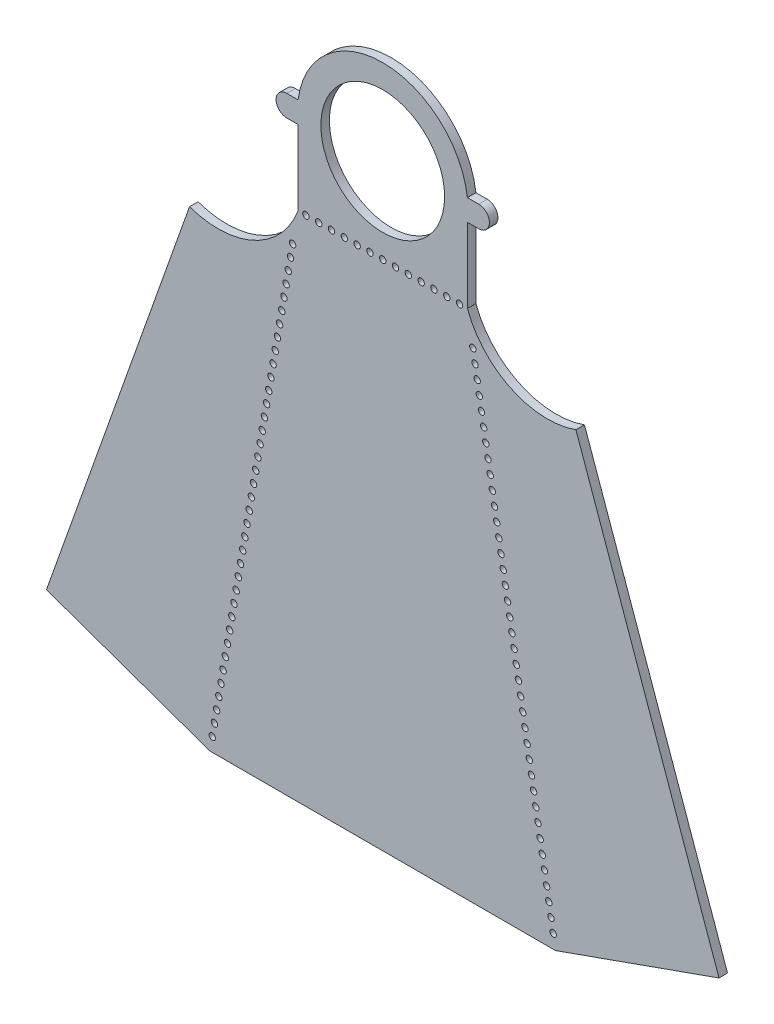
from build123d import *

# Parameters (mm, degrees)
SKETCH1_R                = 14.5
SKETCH1_R_2              = 0.75
EXTRUDE1_DEPTH           = 2
SKETCH2_R                = 0.75
CUT_EXTRUDE1_DEPTH       = 2
LPATTERN1_COUNT          = 38
LPATTERN1_PITCH          = 3
MIRROR1_COPY_1_SKETCH_R  = 0.75
MIRROR1_COPY_1_DEPTH     = 2
MIRROR1_COPY_2_SKETCH_R  = 0.75
MIRROR1_COPY_2_DEPTH     = 2
MIRROR1_COPY_3_SKETCH_R  = 0.75
MIRROR1_COPY_3_DEPTH     = 2
MIRROR1_COPY_4_SKETCH_R  = 0.75
MIRROR1_COPY_4_DEPTH     = 2
MIRROR1_COPY_5_SKETCH_R  = 0.75
MIRROR1_COPY_5_DEPTH     = 2
MIRROR1_COPY_6_SKETCH_R  = 0.75
MIRROR1_COPY_6_DEPTH     = 2
MIRROR1_COPY_7_SKETCH_R  = 0.75
MIRROR1_COPY_7_DEPTH     = 2
MIRROR1_COPY_8_SKETCH_R  = 0.75
MIRROR1_COPY_8_DEPTH     = 2
MIRROR1_COPY_9_SKETCH_R  = 0.75
MIRROR1_COPY_9_DEPTH     = 2
MIRROR1_COPY_10_SKETCH_R = 0.75
MIRROR1_COPY_10_DEPTH    = 2
MIRROR1_COPY_11_SKETCH_R = 0.75
MIRROR1_COPY_11_DEPTH    = 2
MIRROR1_COPY_12_SKETCH_R = 0.75
MIRROR1_COPY_12_DEPTH    = 2
MIRROR1_COPY_13_SKETCH_R = 0.75
MIRROR1_COPY_13_DEPTH    = 2
MIRROR1_COPY_14_SKETCH_R = 0.75
MIRROR1_COPY_14_DEPTH    = 2
MIRROR1_COPY_15_SKETCH_R = 0.75
MIRROR1_COPY_15_DEPTH    = 2
MIRROR1_COPY_16_SKETCH_R = 0.75
MIRROR1_COPY_16_DEPTH    = 2
MIRROR1_COPY_17_SKETCH_R = 0.75
MIRROR1_COPY_17_DEPTH    = 2
MIRROR1_COPY_18_SKETCH_R = 0.75
MIRROR1_COPY_18_DEPTH    = 2
MIRROR1_COPY_19_SKETCH_R = 0.75
MIRROR1_COPY_19_DEPTH    = 2
MIRROR1_COPY_20_SKETCH_R = 0.75
MIRROR1_COPY_20_DEPTH    = 2
MIRROR1_COPY_21_SKETCH_R = 0.75
MIRROR1_COPY_21_DEPTH    = 2
MIRROR1_COPY_22_SKETCH_R = 0.75
MIRROR1_COPY_22_DEPTH    = 2
MIRROR1_COPY_23_SKETCH_R = 0.75
MIRROR1_COPY_23_DEPTH    = 2
MIRROR1_COPY_24_SKETCH_R = 0.75
MIRROR1_COPY_24_DEPTH    = 2
MIRROR1_COPY_25_SKETCH_R = 0.75
MIRROR1_COPY_25_DEPTH    = 2
MIRROR1_COPY_26_SKETCH_R = 0.75
MIRROR1_COPY_26_DEPTH    = 2
MIRROR1_COPY_27_SKETCH_R = 0.75
MIRROR1_COPY_27_DEPTH    = 2
MIRROR1_COPY_28_SKETCH_R = 0.75
MIRROR1_COPY_28_DEPTH    = 2
MIRROR1_COPY_29_SKETCH_R = 0.75
MIRROR1_COPY_29_DEPTH    = 2
MIRROR1_COPY_30_SKETCH_R = 0.75
MIRROR1_COPY_30_DEPTH    = 2
MIRROR1_COPY_31_SKETCH_R = 0.75
MIRROR1_COPY_31_DEPTH    = 2
MIRROR1_COPY_32_SKETCH_R = 0.75
MIRROR1_COPY_32_DEPTH    = 2
MIRROR1_COPY_33_SKETCH_R = 0.75
MIRROR1_COPY_33_DEPTH    = 2
MIRROR1_COPY_34_SKETCH_R = 0.75
MIRROR1_COPY_34_DEPTH    = 2
MIRROR1_COPY_35_SKETCH_R = 0.75
MIRROR1_COPY_35_DEPTH    = 2
MIRROR1_COPY_36_SKETCH_R = 0.75
MIRROR1_COPY_36_DEPTH    = 2
MIRROR1_COPY_37_SKETCH_R = 0.75
MIRROR1_COPY_37_DEPTH    = 2


with BuildPart() as part:
    # Sketch1 → Extrude1 (new body)
    with BuildSketch(Plane.XY):
        with BuildLine():
            Line((-22.5, 2.5), (-19.843134833, 2.5))
            ThreePointArc((-19.843134833, 2.5), (0, 20), (19.843134833, 2.5))
            Line((19.843134833, 2.5), (22.5, 2.5))
            ThreePointArc((22.5, 2.5), (25, 0), (22.5, -2.5))
            Line((22.5, -2.5), (19.843134833, -2.5))
            Line((19.843134833, -2.5), (19.843134833, -20))
            ThreePointArc((19.843134833, -20), (30.124001919, -31.163943441), (45.282979873, -31.89555029))
            Line((45.282979873, -31.89555029), (78.814807982, -126.406117381))
            Line((78.814807982, -126.406117381), (40.5, -140))
            Line((40.5, -140), (-40.5, -140))
            Line((-40.5, -140), (-78.814807982, -126.406117381))
            Line((-78.814807982, -126.406117381), (-45.282979873, -31.89555029))
            ThreePointArc((-45.282979873, -31.89555029), (-30.124001919, -31.163943441), (-19.843134833, -20))
            Line((-19.843134833, -20), (-19.843134833, -2.5))
            Line((-19.843134833, -2.5), (-22.5, -2.5))
            ThreePointArc((-22.5, -2.5), (-25, 0), (-22.5, 2.5))
        make_face()
        Circle(SKETCH1_R, mode=Mode.SUBTRACT)
        with Locations((0, -20)):
            Circle(SKETCH1_R_2, mode=Mode.SUBTRACT)
        with Locations((3, -20)):
            Circle(SKETCH1_R_2, mode=Mode.SUBTRACT)
        with Locations((6, -20)):
            Circle(SKETCH1_R_2, mode=Mode.SUBTRACT)
        with Locations((9, -20)):
            Circle(SKETCH1_R_2, mode=Mode.SUBTRACT)
        with Locations((12, -20)):
            Circle(SKETCH1_R_2, mode=Mode.SUBTRACT)
        with Locations((15, -20)):
            Circle(SKETCH1_R_2, mode=Mode.SUBTRACT)
        with Locations((18, -20)):
            Circle(SKETCH1_R_2, mode=Mode.SUBTRACT)
        with Locations((-3, -20)):
            Circle(SKETCH1_R_2, mode=Mode.SUBTRACT)
        with Locations((-6, -20)):
            Circle(SKETCH1_R_2, mode=Mode.SUBTRACT)
        with Locations((-9, -20)):
            Circle(SKETCH1_R_2, mode=Mode.SUBTRACT)
        with Locations((-12, -20)):
            Circle(SKETCH1_R_2, mode=Mode.SUBTRACT)
        with Locations((-15, -20)):
            Circle(SKETCH1_R_2, mode=Mode.SUBTRACT)
        with Locations((-18, -20)):
            Circle(SKETCH1_R_2, mode=Mode.SUBTRACT)
    extrude(amount=EXTRUDE1_DEPTH)

    # Sketch2 → Cut-Extrude1 (cut)
    with BuildSketch(Plane.XY.offset(2)):
        with Locations((-21.113471472, -27.379648142)):
            Circle(SKETCH2_R)
    cut_extrude1 = extrude(amount=-CUT_EXTRUDE1_DEPTH, mode=Mode.SUBTRACT)

    # LPattern1: Cut-Extrude1 ×38
    with Locations(*[Vector(-0.16964539513438776, -0.9855051699051088, 0) * (i * LPATTERN1_PITCH) for i in range(1, LPATTERN1_COUNT)]):
        add(cut_extrude1, mode=Mode.SUBTRACT)

    # Mirror1: Cut-Extrude1 across plane
    add(cut_extrude1.mirror(Plane(origin=(0, 0, 0), x_dir=(0, 0, 1), z_dir=(1, 0, 0))), mode=Mode.SUBTRACT)

    # Mirror1 copy 1 sketch → Mirror1 copy 1 (cut)
    with BuildSketch(Plane(origin=(0.508936185, -2.95651551, 2), x_dir=(-1, 0, 0), z_dir=(0, 0, 1))):
        with Locations((-21.113471472, 27.379648142)):
            Circle(MIRROR1_COPY_1_SKETCH_R)
    extrude(amount=-MIRROR1_COPY_1_DEPTH, mode=Mode.SUBTRACT)

    # Mirror1 copy 2 sketch → Mirror1 copy 2 (cut)
    with BuildSketch(Plane(origin=(1.017872371, -5.913031019, 2), x_dir=(-1, 0, 0), z_dir=(0, 0, 1))):
        with Locations((-21.113471472, 27.379648142)):
            Circle(MIRROR1_COPY_2_SKETCH_R)
    extrude(amount=-MIRROR1_COPY_2_DEPTH, mode=Mode.SUBTRACT)

    # Mirror1 copy 3 sketch → Mirror1 copy 3 (cut)
    with BuildSketch(Plane(origin=(1.526808556, -8.869546529, 2), x_dir=(-1, 0, 0), z_dir=(0, 0, 1))):
        with Locations((-21.113471472, 27.379648142)):
            Circle(MIRROR1_COPY_3_SKETCH_R)
    extrude(amount=-MIRROR1_COPY_3_DEPTH, mode=Mode.SUBTRACT)

    # Mirror1 copy 4 sketch → Mirror1 copy 4 (cut)
    with BuildSketch(Plane(origin=(2.035744742, -11.826062039, 2), x_dir=(-1, 0, 0), z_dir=(0, 0, 1))):
        with Locations((-21.113471472, 27.379648142)):
            Circle(MIRROR1_COPY_4_SKETCH_R)
    extrude(amount=-MIRROR1_COPY_4_DEPTH, mode=Mode.SUBTRACT)

    # Mirror1 copy 5 sketch → Mirror1 copy 5 (cut)
    with BuildSketch(Plane(origin=(2.544680927, -14.782577549, 2), x_dir=(-1, 0, 0), z_dir=(0, 0, 1))):
        with Locations((-21.113471472, 27.379648142)):
            Circle(MIRROR1_COPY_5_SKETCH_R)
    extrude(amount=-MIRROR1_COPY_5_DEPTH, mode=Mode.SUBTRACT)

    # Mirror1 copy 6 sketch → Mirror1 copy 6 (cut)
    with BuildSketch(Plane(origin=(3.053617112, -17.739093058, 2), x_dir=(-1, 0, 0), z_dir=(0, 0, 1))):
        with Locations((-21.113471472, 27.379648142)):
            Circle(MIRROR1_COPY_6_SKETCH_R)
    extrude(amount=-MIRROR1_COPY_6_DEPTH, mode=Mode.SUBTRACT)

    # Mirror1 copy 7 sketch → Mirror1 copy 7 (cut)
    with BuildSketch(Plane(origin=(3.562553298, -20.695608568, 2), x_dir=(-1, 0, 0), z_dir=(0, 0, 1))):
        with Locations((-21.113471472, 27.379648142)):
            Circle(MIRROR1_COPY_7_SKETCH_R)
    extrude(amount=-MIRROR1_COPY_7_DEPTH, mode=Mode.SUBTRACT)

    # Mirror1 copy 8 sketch → Mirror1 copy 8 (cut)
    with BuildSketch(Plane(origin=(4.071489483, -23.652124078, 2), x_dir=(-1, 0, 0), z_dir=(0, 0, 1))):
        with Locations((-21.113471472, 27.379648142)):
            Circle(MIRROR1_COPY_8_SKETCH_R)
    extrude(amount=-MIRROR1_COPY_8_DEPTH, mode=Mode.SUBTRACT)

    # Mirror1 copy 9 sketch → Mirror1 copy 9 (cut)
    with BuildSketch(Plane(origin=(4.580425669, -26.608639587, 2), x_dir=(-1, 0, 0), z_dir=(0, 0, 1))):
        with Locations((-21.113471472, 27.379648142)):
            Circle(MIRROR1_COPY_9_SKETCH_R)
    extrude(amount=-MIRROR1_COPY_9_DEPTH, mode=Mode.SUBTRACT)

    # Mirror1 copy 10 sketch → Mirror1 copy 10 (cut)
    with BuildSketch(Plane(origin=(5.089361854, -29.565155097, 2), x_dir=(-1, 0, 0), z_dir=(0, 0, 1))):
        with Locations((-21.113471472, 27.379648142)):
            Circle(MIRROR1_COPY_10_SKETCH_R)
    extrude(amount=-MIRROR1_COPY_10_DEPTH, mode=Mode.SUBTRACT)

    # Mirror1 copy 11 sketch → Mirror1 copy 11 (cut)
    with BuildSketch(Plane(origin=(5.598298039, -32.521670607, 2), x_dir=(-1, 0, 0), z_dir=(0, 0, 1))):
        with Locations((-21.113471472, 27.379648142)):
            Circle(MIRROR1_COPY_11_SKETCH_R)
    extrude(amount=-MIRROR1_COPY_11_DEPTH, mode=Mode.SUBTRACT)

    # Mirror1 copy 12 sketch → Mirror1 copy 12 (cut)
    with BuildSketch(Plane(origin=(6.107234225, -35.478186117, 2), x_dir=(-1, 0, 0), z_dir=(0, 0, 1))):
        with Locations((-21.113471472, 27.379648142)):
            Circle(MIRROR1_COPY_12_SKETCH_R)
    extrude(amount=-MIRROR1_COPY_12_DEPTH, mode=Mode.SUBTRACT)

    # Mirror1 copy 13 sketch → Mirror1 copy 13 (cut)
    with BuildSketch(Plane(origin=(6.61617041, -38.434701626, 2), x_dir=(-1, 0, 0), z_dir=(0, 0, 1))):
        with Locations((-21.113471472, 27.379648142)):
            Circle(MIRROR1_COPY_13_SKETCH_R)
    extrude(amount=-MIRROR1_COPY_13_DEPTH, mode=Mode.SUBTRACT)

    # Mirror1 copy 14 sketch → Mirror1 copy 14 (cut)
    with BuildSketch(Plane(origin=(7.125106596, -41.391217136, 2), x_dir=(-1, 0, 0), z_dir=(0, 0, 1))):
        with Locations((-21.113471472, 27.379648142)):
            Circle(MIRROR1_COPY_14_SKETCH_R)
    extrude(amount=-MIRROR1_COPY_14_DEPTH, mode=Mode.SUBTRACT)

    # Mirror1 copy 15 sketch → Mirror1 copy 15 (cut)
    with BuildSketch(Plane(origin=(7.634042781, -44.347732646, 2), x_dir=(-1, 0, 0), z_dir=(0, 0, 1))):
        with Locations((-21.113471472, 27.379648142)):
            Circle(MIRROR1_COPY_15_SKETCH_R)
    extrude(amount=-MIRROR1_COPY_15_DEPTH, mode=Mode.SUBTRACT)

    # Mirror1 copy 16 sketch → Mirror1 copy 16 (cut)
    with BuildSketch(Plane(origin=(8.142978966, -47.304248155, 2), x_dir=(-1, 0, 0), z_dir=(0, 0, 1))):
        with Locations((-21.113471472, 27.379648142)):
            Circle(MIRROR1_COPY_16_SKETCH_R)
    extrude(amount=-MIRROR1_COPY_16_DEPTH, mode=Mode.SUBTRACT)

    # Mirror1 copy 17 sketch → Mirror1 copy 17 (cut)
    with BuildSketch(Plane(origin=(8.651915152, -50.260763665, 2), x_dir=(-1, 0, 0), z_dir=(0, 0, 1))):
        with Locations((-21.113471472, 27.379648142)):
            Circle(MIRROR1_COPY_17_SKETCH_R)
    extrude(amount=-MIRROR1_COPY_17_DEPTH, mode=Mode.SUBTRACT)

    # Mirror1 copy 18 sketch → Mirror1 copy 18 (cut)
    with BuildSketch(Plane(origin=(9.160851337, -53.217279175, 2), x_dir=(-1, 0, 0), z_dir=(0, 0, 1))):
        with Locations((-21.113471472, 27.379648142)):
            Circle(MIRROR1_COPY_18_SKETCH_R)
    extrude(amount=-MIRROR1_COPY_18_DEPTH, mode=Mode.SUBTRACT)

    # Mirror1 copy 19 sketch → Mirror1 copy 19 (cut)
    with BuildSketch(Plane(origin=(9.669787523, -56.173794685, 2), x_dir=(-1, 0, 0), z_dir=(0, 0, 1))):
        with Locations((-21.113471472, 27.379648142)):
            Circle(MIRROR1_COPY_19_SKETCH_R)
    extrude(amount=-MIRROR1_COPY_19_DEPTH, mode=Mode.SUBTRACT)

    # Mirror1 copy 20 sketch → Mirror1 copy 20 (cut)
    with BuildSketch(Plane(origin=(10.178723708, -59.130310194, 2), x_dir=(-1, 0, 0), z_dir=(0, 0, 1))):
        with Locations((-21.113471472, 27.379648142)):
            Circle(MIRROR1_COPY_20_SKETCH_R)
    extrude(amount=-MIRROR1_COPY_20_DEPTH, mode=Mode.SUBTRACT)

    # Mirror1 copy 21 sketch → Mirror1 copy 21 (cut)
    with BuildSketch(Plane(origin=(10.687659893, -62.086825704, 2), x_dir=(-1, 0, 0), z_dir=(0, 0, 1))):
        with Locations((-21.113471472, 27.379648142)):
            Circle(MIRROR1_COPY_21_SKETCH_R)
    extrude(amount=-MIRROR1_COPY_21_DEPTH, mode=Mode.SUBTRACT)

    # Mirror1 copy 22 sketch → Mirror1 copy 22 (cut)
    with BuildSketch(Plane(origin=(11.196596079, -65.043341214, 2), x_dir=(-1, 0, 0), z_dir=(0, 0, 1))):
        with Locations((-21.113471472, 27.379648142)):
            Circle(MIRROR1_COPY_22_SKETCH_R)
    extrude(amount=-MIRROR1_COPY_22_DEPTH, mode=Mode.SUBTRACT)

    # Mirror1 copy 23 sketch → Mirror1 copy 23 (cut)
    with BuildSketch(Plane(origin=(11.705532264, -67.999856723, 2), x_dir=(-1, 0, 0), z_dir=(0, 0, 1))):
        with Locations((-21.113471472, 27.379648142)):
            Circle(MIRROR1_COPY_23_SKETCH_R)
    extrude(amount=-MIRROR1_COPY_23_DEPTH, mode=Mode.SUBTRACT)

    # Mirror1 copy 24 sketch → Mirror1 copy 24 (cut)
    with BuildSketch(Plane(origin=(12.21446845, -70.956372233, 2), x_dir=(-1, 0, 0), z_dir=(0, 0, 1))):
        with Locations((-21.113471472, 27.379648142)):
            Circle(MIRROR1_COPY_24_SKETCH_R)
    extrude(amount=-MIRROR1_COPY_24_DEPTH, mode=Mode.SUBTRACT)

    # Mirror1 copy 25 sketch → Mirror1 copy 25 (cut)
    with BuildSketch(Plane(origin=(12.723404635, -73.912887743, 2), x_dir=(-1, 0, 0), z_dir=(0, 0, 1))):
        with Locations((-21.113471472, 27.379648142)):
            Circle(MIRROR1_COPY_25_SKETCH_R)
    extrude(amount=-MIRROR1_COPY_25_DEPTH, mode=Mode.SUBTRACT)

    # Mirror1 copy 26 sketch → Mirror1 copy 26 (cut)
    with BuildSketch(Plane(origin=(13.23234082, -76.869403253, 2), x_dir=(-1, 0, 0), z_dir=(0, 0, 1))):
        with Locations((-21.113471472, 27.379648142)):
            Circle(MIRROR1_COPY_26_SKETCH_R)
    extrude(amount=-MIRROR1_COPY_26_DEPTH, mode=Mode.SUBTRACT)

    # Mirror1 copy 27 sketch → Mirror1 copy 27 (cut)
    with BuildSketch(Plane(origin=(13.741277006, -79.825918762, 2), x_dir=(-1, 0, 0), z_dir=(0, 0, 1))):
        with Locations((-21.113471472, 27.379648142)):
            Circle(MIRROR1_COPY_27_SKETCH_R)
    extrude(amount=-MIRROR1_COPY_27_DEPTH, mode=Mode.SUBTRACT)

    # Mirror1 copy 28 sketch → Mirror1 copy 28 (cut)
    with BuildSketch(Plane(origin=(14.250213191, -82.782434272, 2), x_dir=(-1, 0, 0), z_dir=(0, 0, 1))):
        with Locations((-21.113471472, 27.379648142)):
            Circle(MIRROR1_COPY_28_SKETCH_R)
    extrude(amount=-MIRROR1_COPY_28_DEPTH, mode=Mode.SUBTRACT)

    # Mirror1 copy 29 sketch → Mirror1 copy 29 (cut)
    with BuildSketch(Plane(origin=(14.759149377, -85.738949782, 2), x_dir=(-1, 0, 0), z_dir=(0, 0, 1))):
        with Locations((-21.113471472, 27.379648142)):
            Circle(MIRROR1_COPY_29_SKETCH_R)
    extrude(amount=-MIRROR1_COPY_29_DEPTH, mode=Mode.SUBTRACT)

    # Mirror1 copy 30 sketch → Mirror1 copy 30 (cut)
    with BuildSketch(Plane(origin=(15.268085562, -88.695465291, 2), x_dir=(-1, 0, 0), z_dir=(0, 0, 1))):
        with Locations((-21.113471472, 27.379648142)):
            Circle(MIRROR1_COPY_30_SKETCH_R)
    extrude(amount=-MIRROR1_COPY_30_DEPTH, mode=Mode.SUBTRACT)

    # Mirror1 copy 31 sketch → Mirror1 copy 31 (cut)
    with BuildSketch(Plane(origin=(15.777021747, -91.651980801, 2), x_dir=(-1, 0, 0), z_dir=(0, 0, 1))):
        with Locations((-21.113471472, 27.379648142)):
            Circle(MIRROR1_COPY_31_SKETCH_R)
    extrude(amount=-MIRROR1_COPY_31_DEPTH, mode=Mode.SUBTRACT)

    # Mirror1 copy 32 sketch → Mirror1 copy 32 (cut)
    with BuildSketch(Plane(origin=(16.285957933, -94.608496311, 2), x_dir=(-1, 0, 0), z_dir=(0, 0, 1))):
        with Locations((-21.113471472, 27.379648142)):
            Circle(MIRROR1_COPY_32_SKETCH_R)
    extrude(amount=-MIRROR1_COPY_32_DEPTH, mode=Mode.SUBTRACT)

    # Mirror1 copy 33 sketch → Mirror1 copy 33 (cut)
    with BuildSketch(Plane(origin=(16.794894118, -97.565011821, 2), x_dir=(-1, 0, 0), z_dir=(0, 0, 1))):
        with Locations((-21.113471472, 27.379648142)):
            Circle(MIRROR1_COPY_33_SKETCH_R)
    extrude(amount=-MIRROR1_COPY_33_DEPTH, mode=Mode.SUBTRACT)

    # Mirror1 copy 34 sketch → Mirror1 copy 34 (cut)
    with BuildSketch(Plane(origin=(17.303830304, -100.52152733, 2), x_dir=(-1, 0, 0), z_dir=(0, 0, 1))):
        with Locations((-21.113471472, 27.379648142)):
            Circle(MIRROR1_COPY_34_SKETCH_R)
    extrude(amount=-MIRROR1_COPY_34_DEPTH, mode=Mode.SUBTRACT)

    # Mirror1 copy 35 sketch → Mirror1 copy 35 (cut)
    with BuildSketch(Plane(origin=(17.812766489, -103.47804284, 2), x_dir=(-1, 0, 0), z_dir=(0, 0, 1))):
        with Locations((-21.113471472, 27.379648142)):
            Circle(MIRROR1_COPY_35_SKETCH_R)
    extrude(amount=-MIRROR1_COPY_35_DEPTH, mode=Mode.SUBTRACT)

    # Mirror1 copy 36 sketch → Mirror1 copy 36 (cut)
    with BuildSketch(Plane(origin=(18.321702675, -106.43455835, 2), x_dir=(-1, 0, 0), z_dir=(0, 0, 1))):
        with Locations((-21.113471472, 27.379648142)):
            Circle(MIRROR1_COPY_36_SKETCH_R)
    extrude(amount=-MIRROR1_COPY_36_DEPTH, mode=Mode.SUBTRACT)

    # Mirror1 copy 37 sketch → Mirror1 copy 37 (cut)
    with BuildSketch(Plane(origin=(18.83063886, -109.391073859, 2), x_dir=(-1, 0, 0), z_dir=(0, 0, 1))):
        with Locations((-21.113471472, 27.379648142)):
            Circle(MIRROR1_COPY_37_SKETCH_R)
    extrude(amount=-MIRROR1_COPY_37_DEPTH, mode=Mode.SUBTRACT)


solid = part.part
